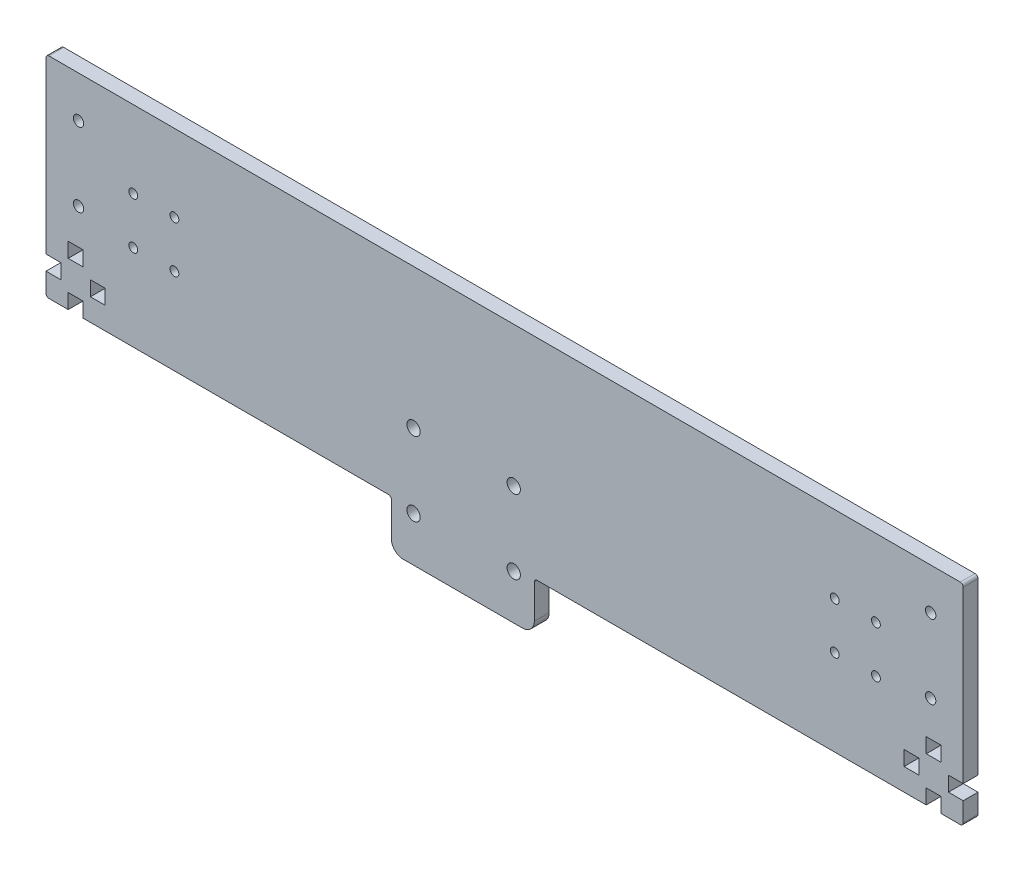
from build123d import *

# Parameters (mm, degrees)
SKETCH1_R           = 1.5
SKETCH1_R_2         = 1.75
SKETCH1_R_3         = 2.25
SKETCH1_W           = 5
SKETCH1_H           = 5
BOSS_EXTRUDE1_DEPTH = 5


with BuildPart() as part:
    # Sketch1 → Boss-Extrude1 (new body)
    with BuildSketch(Plane.XY):
        with BuildLine():
            Line((-10, -2.501863855), (-10, -9.001863855))
            ThreePointArc((-10, -9.001863855), (-9.707106781, -9.708970637), (-9, -10.001863855))
            Line((-9, -10.001863855), (-2.5, -10.001863855))
            Line((-2.5, -10.001863855), (-2.5, -5.001863855))
            Line((-2.5, -5.001863855), (2.5, -5.001863855))
            Line((2.5, -5.001863855), (2.5, -10.001863855))
            Line((2.5, -10.001863855), (105.724043242, -10.001863855))
            ThreePointArc((105.724043242, -10.001863855), (106.431150023, -10.294757074), (106.724043242, -11.001863855))
            Line((106.724043242, -11.001863855), (106.724043242, -22.458474266))
            ThreePointArc((106.724043242, -22.458474266), (107.895616117, -25.286901391), (110.724043242, -26.458474266))
            Line((110.724043242, -26.458474266), (151.039811852, -26.458474266))
            ThreePointArc((151.039811852, -26.458474266), (153.868238976, -25.286901391), (155.039811852, -22.458474266))
            Line((155.039811852, -22.458474266), (155.039811852, -11.001863855))
            ThreePointArc((155.039811852, -11.001863855), (155.33270507, -10.294757074), (156.039811852, -10.001863855))
            Line((156.039811852, -10.001863855), (287.5, -10.001863855))
            Line((287.5, -10.001863855), (287.5, -5.001863855))
            Line((287.5, -5.001863855), (292.5, -5.001863855))
            Line((292.5, -5.001863855), (292.5, -10.001863855))
            Line((292.5, -10.001863855), (299, -10.001863855))
            ThreePointArc((299, -10.001863855), (299.707106781, -9.708970637), (300, -9.001863855))
            Line((300, -9.001863855), (300, -2.501863855))
            Line((300, -2.501863855), (295, -2.501863855))
            Line((295, -2.501863855), (295, 2.498136145))
            Line((295, 2.498136145), (300, 2.498136145))
            Line((300, 2.498136145), (300, 60))
            ThreePointArc((300, 60), (299.707106781, 60.707106781), (299, 61))
            Line((299, 61), (-9, 61))
            ThreePointArc((-9, 61), (-9.707106781, 60.707106781), (-10, 60))
            Line((-10, 60), (-10, 2.498136145))
            Line((-10, 2.498136145), (-5, 2.498136145))
            Line((-5, 2.498136145), (-5, -2.501863855))
            Line((-5, -2.501863855), (-10, -2.501863855))
        make_face()
        with Locations((33.4, 34.947207957)):
            Circle(SKETCH1_R, mode=Mode.SUBTRACT)
        with Locations((19.5, 34.947207957)):
            Circle(SKETCH1_R, mode=Mode.SUBTRACT)
        with Locations((256.6, 34.947207957)):
            Circle(SKETCH1_R, mode=Mode.SUBTRACT)
        with Locations((270.5, 34.947207957)):
            Circle(SKETCH1_R, mode=Mode.SUBTRACT)
        with Locations((270.5, 19.147207957)):
            Circle(SKETCH1_R, mode=Mode.SUBTRACT)
        with Locations((256.6, 19.147207957)):
            Circle(SKETCH1_R, mode=Mode.SUBTRACT)
        with Locations((289, 22.001504258)):
            Circle(SKETCH1_R_2, mode=Mode.SUBTRACT)
        with Locations((19.5, 19.147207957)):
            Circle(SKETCH1_R, mode=Mode.SUBTRACT)
        with Locations((148.082820817, 13.683948234)):
            Circle(SKETCH1_R_3, mode=Mode.SUBTRACT)
        with Locations((148.082820817, -11.316051766)):
            Circle(SKETCH1_R_3, mode=Mode.SUBTRACT)
        with Locations((289, 47.001504258)):
            Circle(SKETCH1_R_2, mode=Mode.SUBTRACT)
        with Locations((1, 22.001504258)):
            Circle(SKETCH1_R_2, mode=Mode.SUBTRACT)
        with Locations((1, 47.001504258)):
            Circle(SKETCH1_R_2, mode=Mode.SUBTRACT)
        with Locations((33.4, 19.147207957)):
            Circle(SKETCH1_R, mode=Mode.SUBTRACT)
        with Locations((114.224914373, -11.316051766)):
            Circle(SKETCH1_R_3, mode=Mode.SUBTRACT)
        with Locations((114.224914373, 13.683948234)):
            Circle(SKETCH1_R_3, mode=Mode.SUBTRACT)
        with Locations((0, 7.498136145)):
            Rectangle(SKETCH1_W, SKETCH1_H, mode=Mode.SUBTRACT)
        with Locations((7.5, -0.001863855)):
            Rectangle(SKETCH1_W, SKETCH1_H, mode=Mode.SUBTRACT)
        with Locations((282.5, -0.001863855)):
            Rectangle(SKETCH1_W, SKETCH1_H, mode=Mode.SUBTRACT)
        with Locations((290, 7.498136145)):
            Rectangle(SKETCH1_W, SKETCH1_H, mode=Mode.SUBTRACT)
    extrude(amount=BOSS_EXTRUDE1_DEPTH)


solid = part.part
